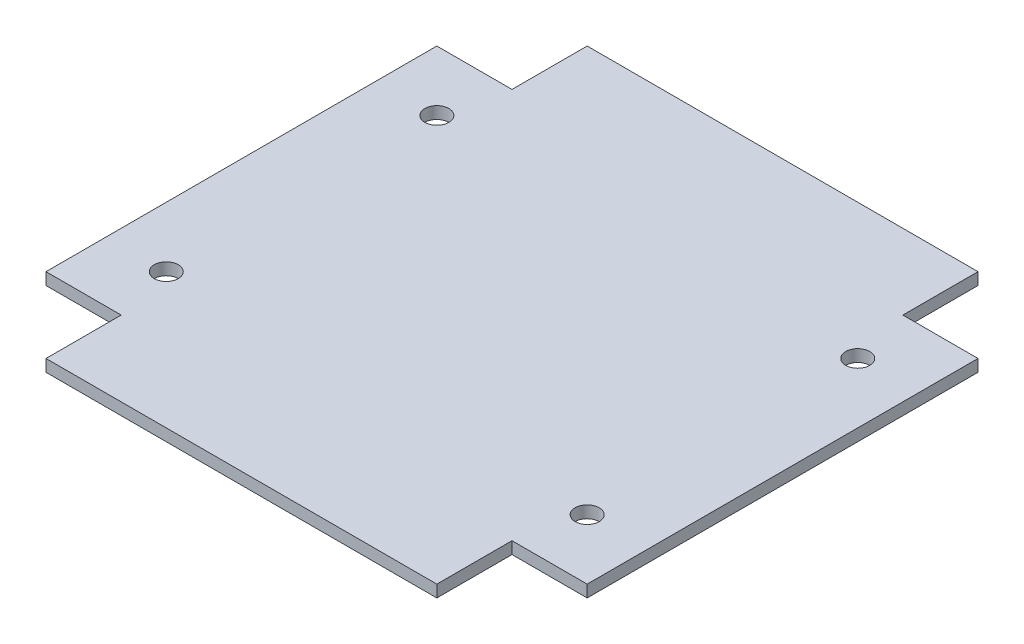
from build123d import *

# Parameters (mm, degrees)
BOSS_EXTRUDE1_DEPTH   = 2
F_4_0MM_DOWEL_HOLE1_D = 4


with BuildPart() as part:
    # Sketch1 → Boss-Extrude1 (new body)
    with BuildSketch(Plane(origin=(0, 0, 0), x_dir=(1, 0, 0), z_dir=(0, 1, 0))):
        Polygon((-53.970588235, 35.110294118), (-41.470588235, 35.110294118), (-41.470588235, 47.610294118), (23.529411765, 47.610294118), (23.529411765, 35.110294118), (36.029411765, 35.110294118), (36.029411765, -29.889705882), (23.529411765, -29.889705882), (23.529411765, -42.389705882), (-41.470588235, -42.389705882), (-41.470588235, -29.889705882), (-53.970588235, -29.889705882), align=None)
    extrude(amount=BOSS_EXTRUDE1_DEPTH)

    # Ø4.0mm Dowel Hole1 (through all)
    with Locations(Plane(origin=(0, 2, 0), x_dir=(1, 0, 0), z_dir=(0, 1, 0))):
        with Locations((-43.970588235, 25.110294118), (26.029411765, 25.110294118), (-43.970588235, -19.889705882), (26.029411765, -19.889705882)):
            Hole(F_4_0MM_DOWEL_HOLE1_D / 2)


solid = part.part
